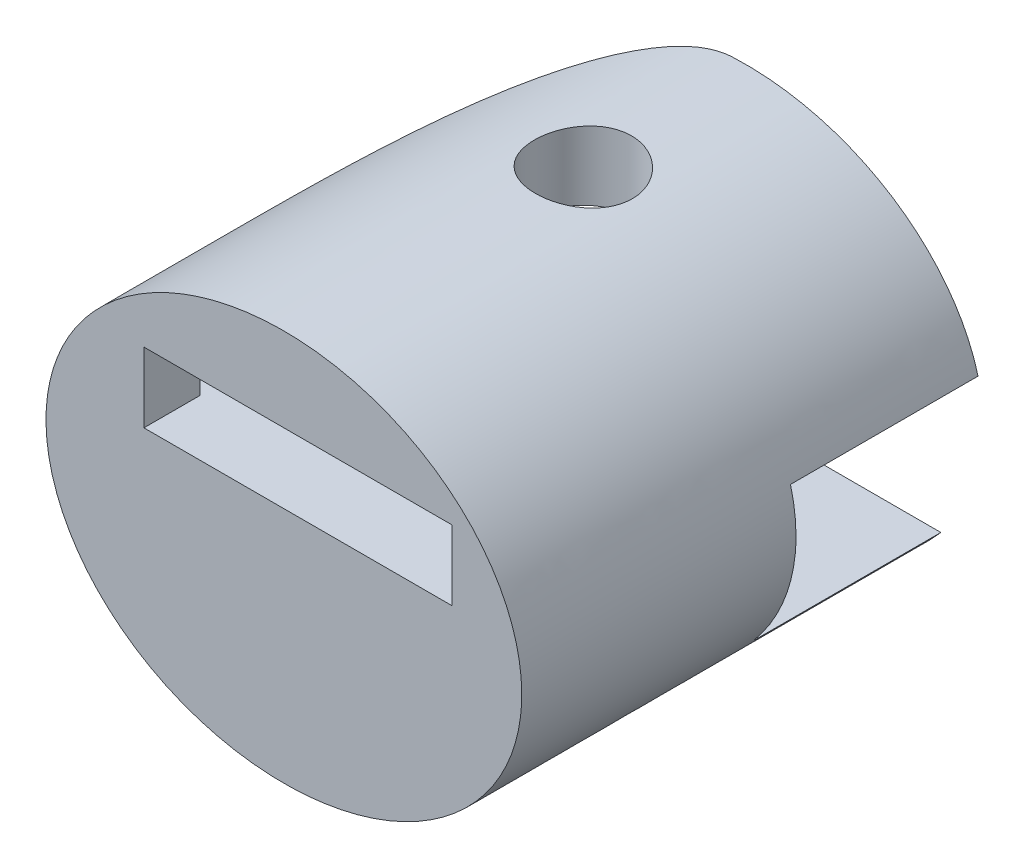
from build123d import *

# Parameters (mm, degrees)
SKETCH1_RX          = 8.5
SKETCH1_RY          = 7
BOSS_EXTRUDE1_DEPTH = 4
SKETCH5_RX          = 8.5
SKETCH5_RY          = 7
BOSS_EXTRUDE2_DEPTH = 12.5
SKETCH6_R           = 1.75
CUT_EXTRUDE1_DEPTH  = 20
SKETCH8_W           = 17
SKETCH8_H           = 5.5
CUT_EXTRUDE4_DEPTH  = 6.7
SKETCH9_W           = 11
SKETCH9_H           = 2.5
CUT_EXTRUDE5_DEPTH  = 5.5
CUT_EXTRUDE7_DEPTH  = 5.5
CUT_EXTRUDE8_DEPTH  = 3
SCALE1_SCALE        = 2


with BuildPart() as part:
    # Sketch1 → Boss-Extrude1 (new body)
    with BuildSketch(Plane.XY):
        with Locations(Location((0, 0), (0, 0, 0))):
            Ellipse(SKETCH1_RX, SKETCH1_RY)
    extrude(amount=BOSS_EXTRUDE1_DEPTH)

    # Sketch5 → Boss-Extrude2 (add)
    with BuildSketch(Plane(origin=(0, 0, 0), x_dir=(-1, 0, 0), z_dir=(0, 0, -1))):
        with Locations(Location((0, 0), (0, 0, -180))):
            Ellipse(SKETCH5_RX, SKETCH5_RY)
    extrude(amount=BOSS_EXTRUDE2_DEPTH)

    # Sketch6 → Cut-Extrude1 (cut)
    with BuildSketch(Plane(origin=(0, 10, 0), x_dir=(1, 0, 0), z_dir=(0, 1, 0))):
        with Locations(Location((0.2, 6.5, 0), (0, 0, 270))):
            Circle(SKETCH6_R)
        with BuildLine():
            Line((-8.5, 12.5), (-8.5, 0))
            Line((-8.5, 0), (-6.5, 0))
            add(Edge.make_bspline(
                [(-6.5, 0), (-6.5, 5.077021549), (-3.853880334, 12.5), (-0.5, 12.5)],
                knots=[0, 0, 0, 0, 1, 1, 1, 1], degree=3))
            Line((-0.5, 12.5), (-8.5, 12.5))
        make_face()
    extrude(amount=-CUT_EXTRUDE1_DEPTH, mode=Mode.SUBTRACT)

    # Sketch8 → Cut-Extrude4 (cut)
    with BuildSketch(Plane.XY.offset(-12.5)):
        with Locations((0, -1.25)):
            Rectangle(SKETCH8_W, SKETCH8_H)
    extrude(amount=CUT_EXTRUDE4_DEPTH, mode=Mode.SUBTRACT)

    # Sketch9 → Cut-Extrude5 (cut)
    with BuildSketch(Plane.XY.offset(4)):
        with Locations((0.5, 2.75)):
            Rectangle(SKETCH9_W, SKETCH9_H)
    extrude(amount=-CUT_EXTRUDE5_DEPTH, mode=Mode.SUBTRACT)

    # Sketch10 → Cut-Extrude7 (cut)
    with BuildSketch(Plane(origin=(0, -4, 0), x_dir=(1, 0, 0), z_dir=(0, 1, 0))):
        Polygon((-8.5, 0), (3.5, 0), (5.725540357, 5.8), (-8.5, 5.8), align=None)
    extrude(amount=CUT_EXTRUDE7_DEPTH, mode=Mode.SUBTRACT)

    # Sketch11 → Cut-Extrude8 (cut)
    with BuildSketch(Plane(origin=(0, 1.5, 0), x_dir=(-1, 0, 0), z_dir=(0, -1, 0))):
        Polygon((-0.2, 6.5), (-0.2, 12.5), (8.5, 12.5), (8.5, 1.5), (8.5, -2), (-6, -2), (-6, 1.5), align=None)
    extrude(amount=-CUT_EXTRUDE8_DEPTH, mode=Mode.SUBTRACT)


with BuildPart() as part_1:
    # Scale1: scaled about (1.259390776, -0.158043462, -2.5785604)
    add(part.part.scale(SCALE1_SCALE).moved(Location((-1.259390776, 0.158043462, 2.5785604))))


solid = part_1.part
